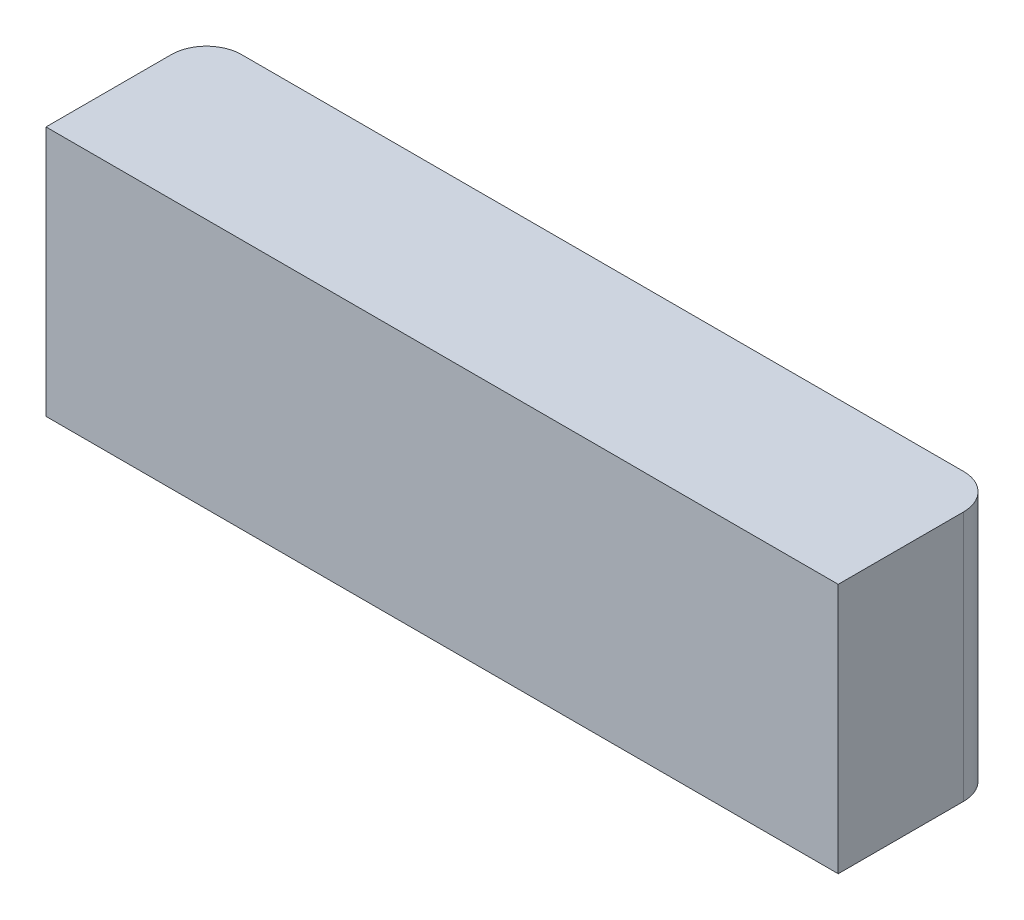
from build123d import *

# Parameters (mm, degrees)
BOSS_EXTRUDE1_DEPTH = 37.5


with BuildPart() as part:
    # Sketch1 → Boss-Extrude1 (new, symmetric)
    with BuildSketch(Plane(origin=(0, 0, 0), x_dir=(1, 0, 0), z_dir=(0, 1, 0))):
        with BuildLine():
            Line((-108, 24), (108, 24))
            ThreePointArc((108, 24), (115.424621202, 20.924621202), (118.5, 13.5))
            Line((118.5, 13.5), (118.5, -24))
            Line((118.5, -24), (-118.5, -24))
            Line((-118.5, -24), (-118.5, 13.5))
            ThreePointArc((-118.5, 13.5), (-115.424621202, 20.924621202), (-108, 24))
        make_face()
    extrude(amount=BOSS_EXTRUDE1_DEPTH, both=True)


solid = part.part
